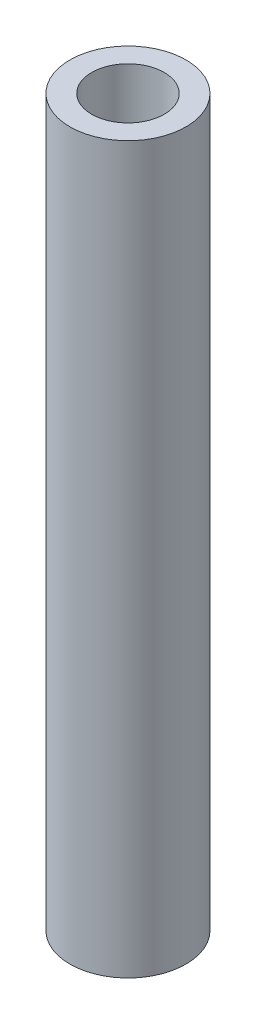
from build123d import *

# Parameters (mm, degrees)
SKETCH1_R           = 1.6
SKETCH1_R_2         = 1
BOSS_EXTRUDE1_DEPTH = 20


with BuildPart() as part:
    # Sketch1 → Boss-Extrude1 (new body)
    with BuildSketch(Plane(origin=(0, 0, 0), x_dir=(1, 0, 0), z_dir=(0, 1, 0))):
        with Locations(Location((0, 0, 0), (0, 0, 270))):
            Circle(SKETCH1_R)
        with Locations(Location((0, 0, 0), (0, 0, 270))):
            Circle(SKETCH1_R_2, mode=Mode.SUBTRACT)
    extrude(amount=BOSS_EXTRUDE1_DEPTH)


solid = part.part
